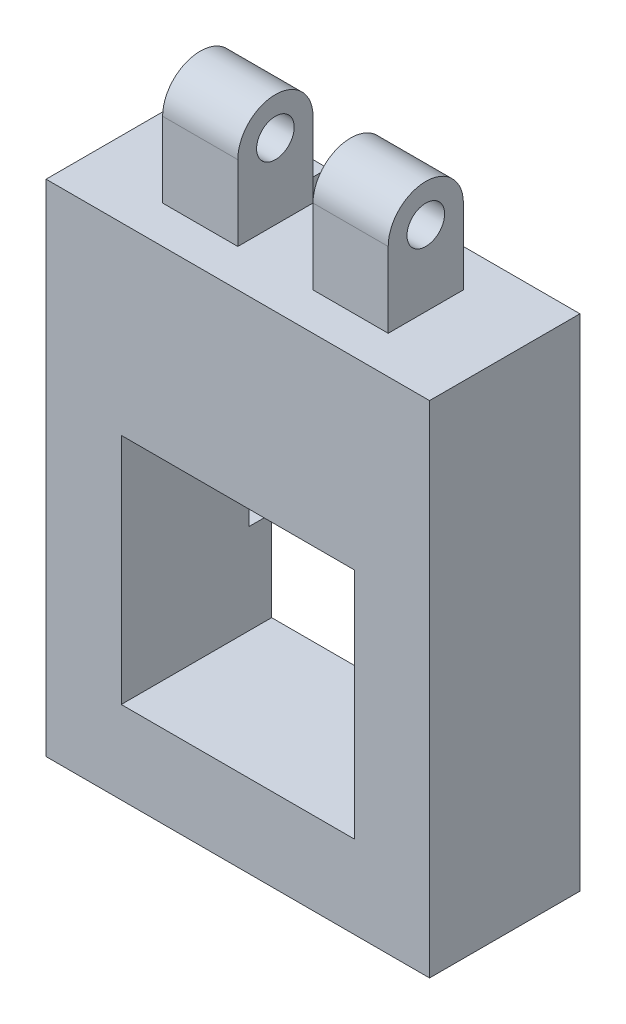
from build123d import *

# Parameters (mm, degrees)
SKETCH1_W           = 50
SKETCH1_H           = 40
BOSS_EXTRUDE1_DEPTH = 10
SKETCH5_W           = 6
SKETCH5_H           = 5
BOSS_EXTRUDE3_DEPTH = 10
SKETCH6_R           = 2
CUT_EXTRUDE1_DEPTH  = 20
SKETCH8_W           = 10
SKETCH8_H           = 40
CUT_EXTRUDE2_DEPTH  = 25
SKETCH9_W           = 10
SKETCH9_H           = 6
SKETCH9_R           = 1.930897171
BOSS_EXTRUDE4_DEPTH = 5
SKETCH10_W          = 10
SKETCH10_H          = 5
CUT_EXTRUDE3_DEPTH  = 15
SKETCH11_W          = 5
SKETCH11_H          = 5
BOSS_EXTRUDE5_DEPTH = 10
SKETCH12_R          = 1.5
CUT_EXTRUDE4_DEPTH  = 10
SKETCH13_W          = 6
SKETCH13_H          = 5
CUT_EXTRUDE5_DEPTH  = 10
SKETCH15_W          = 5
SKETCH15_H          = 5
BOSS_EXTRUDE7_DEPTH = 10
SKETCH18_W          = 5
SKETCH18_H          = 5
CUT_EXTRUDE7_DEPTH  = 10
SKETCH19_R          = 1.25
CUT_EXTRUDE8_DEPTH  = 43
CUT_EXTRUDE9_DEPTH  = 20
SKETCH21_W          = 15.5
SKETCH21_H          = 15.5
CUT_EXTRUDE10_DEPTH = 30
SKETCH22_W          = 8
SKETCH22_H          = 12.25
CUT_EXTRUDE11_DEPTH = 2
SCALE2_SCALE        = 2
CUT_EXTRUDE12_DEPTH = 30
SKETCH24_W          = 44
SKETCH24_H          = 7
CUT_EXTRUDE13_DEPTH = 3


with BuildPart() as part:
    # Sketch1 → Boss-Extrude1 (new body)
    with BuildSketch(Plane(origin=(669.84184187, 0, 0), x_dir=(1, 0, 0), z_dir=(0, 0, 1))):
        with Locations((-671.310344828, 437.637931034)):
            Rectangle(SKETCH1_W, SKETCH1_H)
    boss_extrude1 = extrude(amount=BOSS_EXTRUDE1_DEPTH)

    # Sketch5 → Boss-Extrude3 (add)
    with BuildSketch(Plane(origin=(23.531497042, 0, 0), x_dir=(0, 0, -1), z_dir=(1, 0, 0))):
        with Locations((-5, 442.637931034)):
            Rectangle(SKETCH5_W, SKETCH5_H)
        with Locations((-5, 432.637931034)):
            Rectangle(SKETCH5_W, SKETCH5_H)
    extrude(amount=BOSS_EXTRUDE3_DEPTH)

    # Sketch6 → Cut-Extrude1 (cut)
    with BuildSketch(Plane(origin=(669.84184187, 445.137931034, 0), x_dir=(1, 0, 0), z_dir=(0, 1, 0))):
        with Locations(Location((-641.310344828, -5, 0), (0, 0, 180))):
            Circle(SKETCH6_R)
    extrude(amount=-CUT_EXTRUDE1_DEPTH, mode=Mode.SUBTRACT)

    # Sketch8 → Cut-Extrude2 (cut)
    with BuildSketch(Plane.ZY.offset(26.468502958)):
        with Locations((5, 437.637931034)):
            Rectangle(SKETCH8_W, SKETCH8_H)
    extrude(amount=-CUT_EXTRUDE2_DEPTH, mode=Mode.SUBTRACT)

    # Sketch9 → Boss-Extrude4 (add)
    with BuildSketch(Plane(origin=(0, 435.137931034, 0), x_dir=(1, 0, 0), z_dir=(0, 1, 0))):
        with Locations((28.531497042, -5)):
            Rectangle(SKETCH9_W, SKETCH9_H)
        with Locations(Location((28.531497042, -5, 0), (0, 0, 180))):
            Circle(SKETCH9_R, mode=Mode.SUBTRACT)
    extrude(amount=BOSS_EXTRUDE4_DEPTH)

    # Sketch10 → Cut-Extrude3 (cut)
    with BuildSketch(Plane.XY.offset(8)):
        with Locations((28.531497042, 432.637931034)):
            Rectangle(SKETCH10_W, SKETCH10_H)
        with Locations((28.531497042, 442.637931034)):
            Rectangle(SKETCH10_W, SKETCH10_H)
    extrude(amount=-CUT_EXTRUDE3_DEPTH, mode=Mode.SUBTRACT)

    # Mirror1: Boss-Extrude1 across plane
    add(boss_extrude1.mirror(Plane(origin=(-1.468502958, 0, 0), x_dir=(0, 0, 1), z_dir=(1, 0, 0))))

    # Sketch11 → Boss-Extrude5 (add)
    with BuildSketch(Plane(origin=(0, 457.637931034, 0), x_dir=(1, 0, 0), z_dir=(0, 1, 0))):
        with Locations((-1.468502958, -5)):
            Rectangle(SKETCH11_W, SKETCH11_H)
    extrude(amount=BOSS_EXTRUDE5_DEPTH)

    # Sketch12 → Cut-Extrude4 (cut)
    with BuildSketch(Plane(origin=(1.031497042, 0, 0), x_dir=(0, 0, -1), z_dir=(1, 0, 0))):
        with Locations((-5, 462.637931034)):
            Circle(SKETCH12_R)
    extrude(amount=-CUT_EXTRUDE4_DEPTH, mode=Mode.SUBTRACT)

    # Sketch13 → Cut-Extrude5 (cut)
    with BuildSketch(Plane(origin=(33.531497042, 0, 0), x_dir=(0, 0, -1), z_dir=(1, 0, 0))):
        with Locations((-5, 437.637931034)):
            Rectangle(SKETCH13_W, SKETCH13_H)
    extrude(amount=-CUT_EXTRUDE5_DEPTH, mode=Mode.SUBTRACT)

    # Sketch15 → Boss-Extrude7 (add)
    with BuildSketch(Plane(origin=(0, 457.637931034, 0), x_dir=(1, 0, 0), z_dir=(0, 1, 0))):
        with Locations((-6.468502958, -5)):
            Rectangle(SKETCH15_W, SKETCH15_H)
        with Locations((3.531497042, -5)):
            Rectangle(SKETCH15_W, SKETCH15_H)
    extrude(amount=BOSS_EXTRUDE7_DEPTH)

    # Sketch18 → Cut-Extrude7 (cut)
    with BuildSketch(Plane(origin=(0, 467.637931034, 0), x_dir=(1, 0, 0), z_dir=(0, 1, 0))):
        with Locations((-1.468502958, -5)):
            Rectangle(SKETCH18_W, SKETCH18_H)
    extrude(amount=-CUT_EXTRUDE7_DEPTH, mode=Mode.SUBTRACT)

    # Sketch19 → Cut-Extrude8 (cut)
    with BuildSketch(Plane.ZY.offset(8.968502958)):
        with Locations((5, 462.637931034)):
            Circle(SKETCH19_R)
    extrude(amount=-CUT_EXTRUDE8_DEPTH, mode=Mode.SUBTRACT)

    # Sketch20 → Cut-Extrude9 (cut)
    with BuildSketch(Plane(origin=(6.031497042, 0, 0), x_dir=(0, 0, -1), z_dir=(1, 0, 0))):
        with BuildLine():
            Line((-7.5, 467.637931034), (-7.5, 462.637931034))
            ThreePointArc((-7.5, 462.637931034), (-5, 465.137931034), (-2.5, 462.637931034))
            Line((-2.5, 462.637931034), (-2.5, 467.637931034))
            Line((-2.5, 467.637931034), (-7.5, 467.637931034))
        make_face()
    extrude(amount=-CUT_EXTRUDE9_DEPTH, mode=Mode.SUBTRACT)

    # Sketch21 → Cut-Extrude10 (cut)
    with BuildSketch(Plane.XY.offset(10)):
        with Locations((-1.468502958, 437.637931034)):
            Rectangle(SKETCH21_W, SKETCH21_H)
    extrude(amount=-CUT_EXTRUDE10_DEPTH, mode=Mode.SUBTRACT)

    # Sketch22 → Cut-Extrude11 (cut)
    with BuildSketch(Plane(origin=(0, 0, 0), x_dir=(-1, 0, 0), z_dir=(0, 0, -1))):
        with Locations((1.468502958, 451.512931034)):
            Rectangle(SKETCH22_W, SKETCH22_H)
    extrude(amount=-CUT_EXTRUDE11_DEPTH, mode=Mode.SUBTRACT)


with BuildPart() as part_1:
    # Scale2: scaled about (-1.468502958, 437.877293221, 5.044292315)
    add(part.part.scale(SCALE2_SCALE).moved(Location((1.468502958, -437.877293221, -5.044292315))))

    # Sketch23 → Cut-Extrude12 (cut)
    with BuildSketch(Plane(origin=(0, 0, -5.044292315), x_dir=(-1, 0, 0), z_dir=(0, 0, -1))):
        Polygon((26.968502958, 495.287404552), (26.968502958, 477.398568848), (51.468502958, 477.398568848), (51.468502958, 397.398568848), (-48.531497042, 397.398568848), (-48.531497042, 477.398568848), (-24.031497042, 477.398568848), (-24.031497042, 495.287404552), (-71.530370383, 495.287404552), (-71.530370383, 371.111775085), (85.960671869, 371.111775085), (85.960671869, 495.287404552), align=None)
        Polygon((51.468502958, 477.398568848), (26.968502958, 477.398568848), (26.968502958, 410.898568848), (-24.031497042, 410.898568848), (-24.031497042, 477.398568848), (-48.531497042, 477.398568848), (-48.531497042, 397.398568848), (51.468502958, 397.398568848), align=None)
    extrude(amount=-CUT_EXTRUDE12_DEPTH, mode=Mode.SUBTRACT)

    # Sketch24 → Cut-Extrude13 (cut)
    with BuildSketch(Plane(origin=(0, 0, -5.044292315), x_dir=(-1, 0, 0), z_dir=(0, 0, -1))):
        with Locations((1.468502958, 437.398568848)):
            Rectangle(SKETCH24_W, SKETCH24_H)
    extrude(amount=-CUT_EXTRUDE13_DEPTH, mode=Mode.SUBTRACT)


solid = part_1.part
